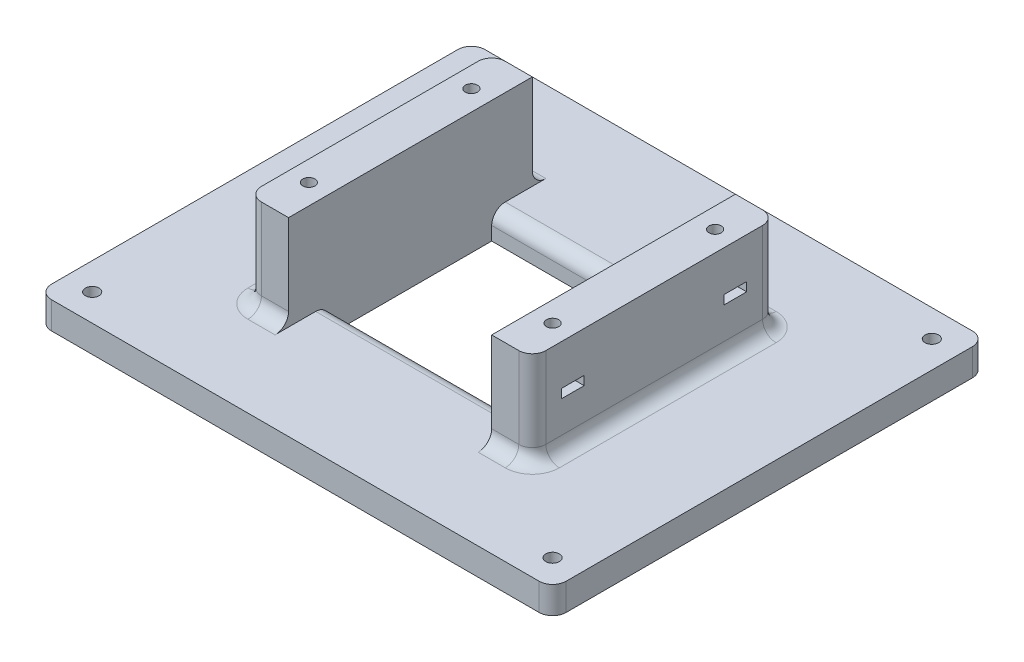
from build123d import *

# Parameters (mm, degrees)
SKETCH1_W           = 190
SKETCH1_H           = 160
BOSS_EXTRUDE1_DEPTH = 10
SKETCH3_W           = 15
SKETCH3_H           = 90
BOSS_EXTRUDE3_DEPTH = 35
SKETCH4_R           = 2.25
CUT_EXTRUDE1_DEPTH  = 50
SKETCH5_W           = 75
SKETCH5_H           = 60
CUT_EXTRUDE2_DEPTH  = 50
SKETCH8_R           = 2.5
CUT_EXTRUDE4_DEPTH  = 10
FILLET1_R           = 5
FILLET2_R           = 5
CUT_EXTRUDE5_DEPTH  = 3.3


with BuildPart() as part:
    # Sketch1 → Boss-Extrude1 (new body)
    with BuildSketch(Plane(origin=(0, 0, 0), x_dir=(1, 0, 0), z_dir=(0, 1, 0))):
        with Locations((95, 80)):
            Rectangle(SKETCH1_W, SKETCH1_H)
    extrude(amount=BOSS_EXTRUDE1_DEPTH)

    # Sketch3 → Boss-Extrude3 (add)
    with BuildSketch(Plane(origin=(0, 10, 0), x_dir=(1, 0, 0), z_dir=(0, 1, 0))):
        with Locations((50, 80)):
            Rectangle(SKETCH3_W, SKETCH3_H)
        with Locations((140, 80)):
            Rectangle(SKETCH3_W, SKETCH3_H)
    extrude(amount=BOSS_EXTRUDE3_DEPTH)

    # Sketch4 → Cut-Extrude1 (cut)
    with BuildSketch(Plane(origin=(0, 45, 0), x_dir=(1, 0, 0), z_dir=(0, 1, 0))):
        with Locations(Location((50, 110, 0), (0, 0, 270))):
            Circle(SKETCH4_R)
        with Locations(Location((140, 110, 0), (0, 0, 270))):
            Circle(SKETCH4_R)
        with Locations(Location((140, 50, 0), (0, 0, 270))):
            Circle(SKETCH4_R)
        with Locations(Location((50, 50, 0), (0, 0, 270))):
            Circle(SKETCH4_R)
    extrude(amount=-CUT_EXTRUDE1_DEPTH, mode=Mode.SUBTRACT)

    # Sketch5 → Cut-Extrude2 (cut)
    with BuildSketch(Plane(origin=(0, 10, 0), x_dir=(1, 0, 0), z_dir=(0, 1, 0))):
        with Locations((95, 80)):
            Rectangle(SKETCH5_W, SKETCH5_H)
    extrude(amount=-CUT_EXTRUDE2_DEPTH, mode=Mode.SUBTRACT)

    # Sketch8 → Cut-Extrude4 (cut)
    with BuildSketch(Plane(origin=(0, 10, 0), x_dir=(1, 0, 0), z_dir=(0, 1, 0))):
        with Locations(Location((10, 150, 0), (0, 0, 270))):
            Circle(SKETCH8_R)
        with Locations(Location((180, 150, 0), (0, 0, 270))):
            Circle(SKETCH8_R)
        with Locations(Location((180, 10, 0), (0, 0, 270))):
            Circle(SKETCH8_R)
        with Locations(Location((10, 10, 0), (0, 0, 270))):
            Circle(SKETCH8_R)
    extrude(amount=-CUT_EXTRUDE4_DEPTH, mode=Mode.SUBTRACT)

    # Fillet1
    fillet1_edges = [part.edges().sort_by_distance(p)[0] for p in [
        (50, 10, -125),
        (42.5, 10, -80),
        (42.5, 27.5, -125),
        (50, 10, -35),
        (42.5, 27.5, -35),
        (147.5, 10, -80),
        (147.5, 27.5, -35),
        (140, 10, -125),
        (147.5, 27.5, -125),
        (140, 10, -35),
        (0, 5, -160),
        (190, 5, -160),
        (190, 5, 0),
        (0, 5, 0),
    ]]
    fillet(fillet1_edges, radius=FILLET1_R)

    # Fillet2
    fillet2_edges = [part.edges().sort_by_distance(p)[0] for p in [
        (95, 10, -50),
        (95, 10, -110),
    ]]
    fillet(fillet2_edges, radius=FILLET2_R)

    # Sketch10 → Cut-Extrude5 (cut)
    with BuildSketch(Plane(origin=(0, 30, 0), x_dir=(1, 0, 0), z_dir=(0, 1, 0))):
        Polygon((45.851380251, 54.148619749), (42.5, 54.148619749), (42.5, 45.848619749), (45.845857409, 45.848619749), (54.151380251, 45.848619749), (54.151380251, 54.148619749), align=None)
        Polygon((42.5, 105.848619749), (45.845857409, 105.848619749), (54.151380251, 105.848619749), (54.151380251, 114.148619749), (45.851380251, 114.148619749), (42.5, 114.148619749), align=None)
        Polygon((147.5, 45.848619749), (144.154142591, 45.848619749), (135.848619749, 45.848619749), (135.848619749, 54.148619749), (144.148619749, 54.148619749), (147.5, 54.148619749), align=None)
        Polygon((147.5, 114.148619749), (147.5, 105.848619749), (144.154142591, 105.848619749), (135.848619749, 105.848619749), (135.848619749, 114.148619749), (144.148619749, 114.148619749), align=None)
    extrude(amount=-CUT_EXTRUDE5_DEPTH, mode=Mode.SUBTRACT)


solid = part.part
